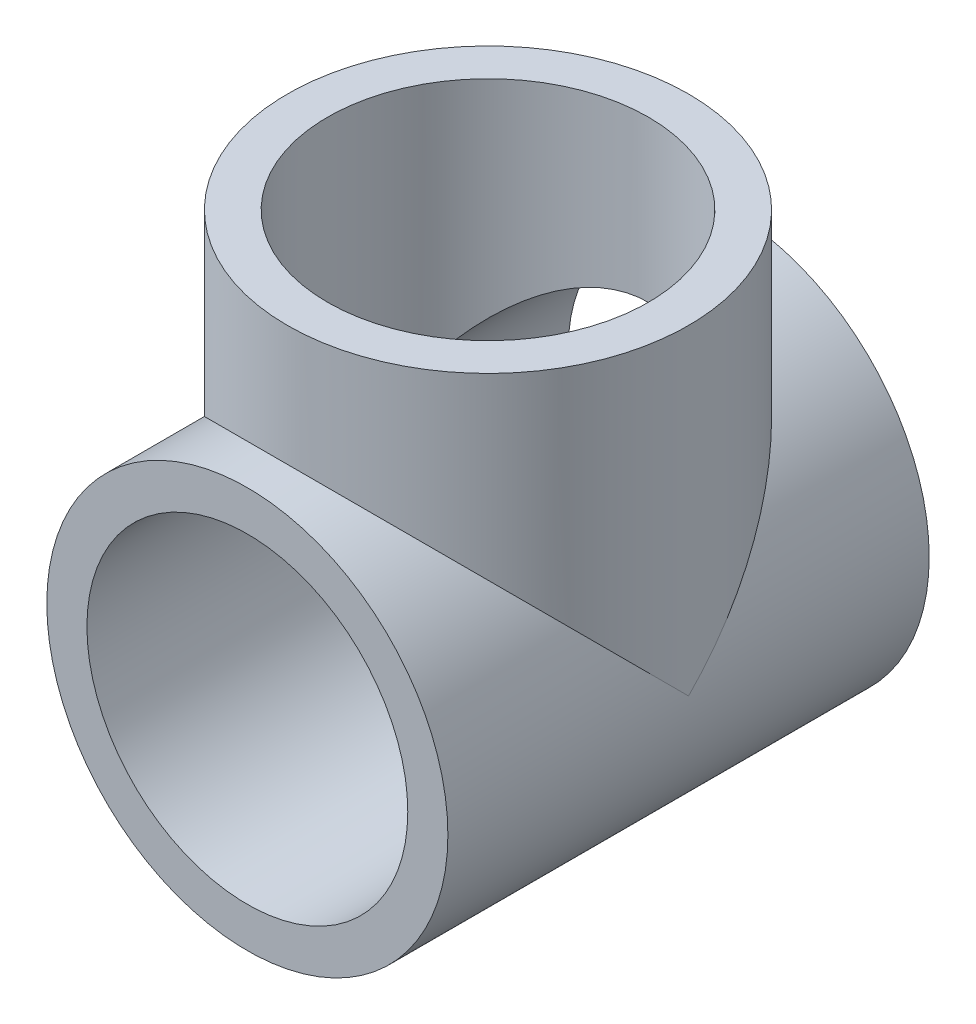
from build123d import *

# Parameters (mm, degrees)
SKETCH_1_R           = 12.5
SKETCH_1_R_2         = 10
EXTRUDE_1_DEPTH      = 15
EXTRUDE_2_REACH      = 39.914
EXTRUDE_2_END_RADIUS = 12.5
SKETCH_2_R           = 12.5
SKETCH_2_R_2         = 10
SKETCH_3_R           = 10
CUT_EXTRUDE_1_DEPTH  = 20


with BuildPart() as part:
    # 草图1 → 凸台-拉伸1 (new, symmetric)
    with BuildSketch(Plane.XY):
        Circle(SKETCH_1_R)
        Circle(SKETCH_1_R_2, mode=Mode.SUBTRACT)
    extrude(amount=EXTRUDE_1_DEPTH, both=True)

    # 凸台-拉伸2: up to this cylinder (the profile starts outside it)
    extrude_2_end = Plane(origin=(0, 0, -12.146447), z_dir=(0, 0, -1)) * Cylinder(EXTRUDE_2_END_RADIUS, 105.828, mode=Mode.PRIVATE)
    # 草图2 → 凸台-拉伸2 (add, up to the surface)
    with BuildSketch(Plane(origin=(0, 20, 0), x_dir=(1, 0, 0), z_dir=(0, 1, 0)), mode=Mode.PRIVATE) as extrude_2_sk1:
        with Locations(Location((0, 0, 0), (0, 0, 270))):
            Circle(SKETCH_2_R)
        with Locations(Location((0, 0, 0), (0, 0, 270))):
            Circle(SKETCH_2_R_2, mode=Mode.SUBTRACT)
    extrude_2_tool1 = extrude(extrude_2_sk1.sketch, amount=-EXTRUDE_2_REACH, mode=Mode.PRIVATE) - extrude_2_end
    add(extrude_2_tool1.solids().sort_by_distance((0, 20, -12.146447))[0])

    # 草图3 → 切除-拉伸1 (cut)
    with BuildSketch(Plane(origin=(0, 20, 0), x_dir=(1, 0, 0), z_dir=(0, 1, 0))):
        with Locations(Location((0, 0, 0), (0, 0, 270))):
            Circle(SKETCH_3_R)
    extrude(amount=-CUT_EXTRUDE_1_DEPTH, mode=Mode.SUBTRACT)


solid = part.part
